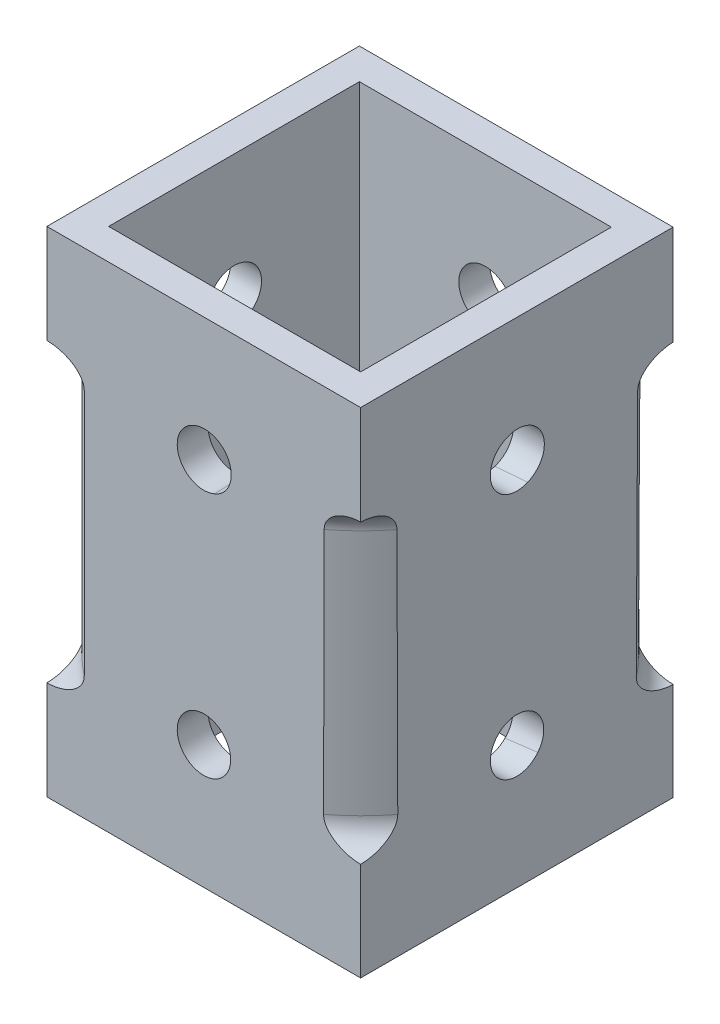
from build123d import *

# Parameters (mm, degrees)
SKETCH1_W           = 25.4
SKETCH1_H           = 25.3
SKETCH1_W_2         = 20.4
SKETCH1_H_2         = 20.3
BOSS_EXTRUDE1_DEPTH = 40
SKETCH3_R           = 2.15
CUT_EXTRUDE1_DEPTH  = 40
CIRPATTERN1_COUNT   = 4


with BuildPart() as part:
    # Sketch1 → Boss-Extrude1 (new body)
    with BuildSketch(Plane(origin=(0, 0, 0), x_dir=(1, 0, 0), z_dir=(0, 1, 0))):
        Rectangle(SKETCH1_W, SKETCH1_H)
        Rectangle(SKETCH1_W_2, SKETCH1_H_2, mode=Mode.SUBTRACT)
    extrude(amount=BOSS_EXTRUDE1_DEPTH)

    # Sketch2 → Cut-Revolve1 (revolve, cut)
    with BuildSketch(Plane(origin=(0, 0, 0), x_dir=(0.7085000909771346, 0, -0.705710720540217), z_dir=(0.705710720540217, 0, 0.7085000909771346))):
        with BuildLine():
            Line((-19.92519177, 10), (-19.92519177, 30))
            ThreePointArc((-19.92519177, 30), (-17.92519177, 32), (-15.92519177, 30))
            Line((-15.92519177, 30), (-15.92519177, 10))
            ThreePointArc((-15.92519177, 10), (-17.92519177, 8), (-19.92519177, 10))
        make_face()
    revolve(axis=Axis((0.050098416, 40, -0.049901178), (-0.0012524584496105494, -0.9999984375102502, 0.0012475275108325553)), mode=Mode.SUBTRACT)

    # Sketch3 → Cut-Extrude1 (cut, symmetric)
    with BuildSketch(Plane.XY.offset(-10.15)):
        with Locations((0, 30)):
            Circle(SKETCH3_R)
        with Locations((0, 10)):
            Circle(SKETCH3_R)
    cut_extrude1 = extrude(amount=CUT_EXTRUDE1_DEPTH, both=True, mode=Mode.SUBTRACT)

    # CirPattern1: Cut-Extrude1 ×4 about axis
    cirpattern1_axis = Axis((0.050098416, 40, -0.049901178), (-0.0012524584496105494, -0.9999984375102502, 0.0012475275108325553))
    for i in range(1, CIRPATTERN1_COUNT):
        add(cut_extrude1.rotate(cirpattern1_axis, i * 360 / CIRPATTERN1_COUNT), mode=Mode.SUBTRACT)


solid = part.part
